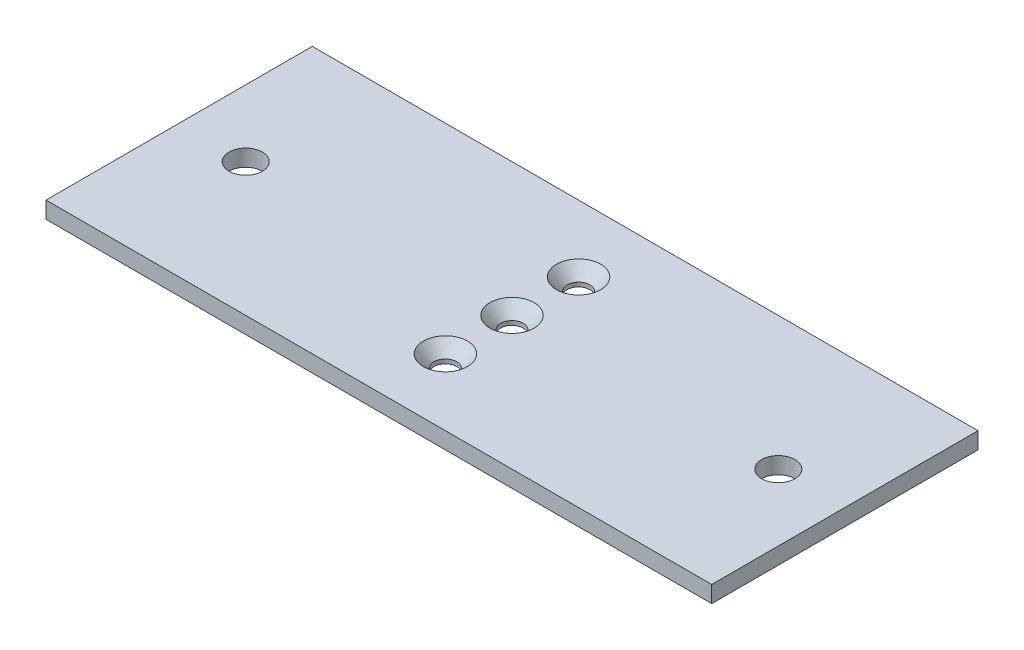
from build123d import *

# Parameters (mm, degrees)
SKETCH1_W                                     = 127
SKETCH1_H                                     = 50.8
BOSS_EXTRUDE1_DEPTH                           = 3.175
SKETCH2_R                                     = 3.175
CUT_EXTRUDE1_DEPTH                            = 6.35
CSK_FOR_8_FLAT_HEAD_MACHINE_SCREW1_AT_2_COUNT = 2
CSK_FOR_8_FLAT_HEAD_MACHINE_SCREW1_AT_2_PITCH = 12.7
CSK_FOR_8_FLAT_HEAD_MACHINE_SCREW1_AT_3_COUNT = 2
CSK_FOR_8_FLAT_HEAD_MACHINE_SCREW1_AT_3_PITCH = 25.4


with BuildPart() as part:
    # Sketch1 → Boss-Extrude1 (new body)
    with BuildSketch(Plane(origin=(0, 0, 0), x_dir=(1, 0, 0), z_dir=(0, 1, 0))):
        with Locations((63.5, 25.4)):
            Rectangle(SKETCH1_W, SKETCH1_H)
    extrude(amount=BOSS_EXTRUDE1_DEPTH)

    # Sketch2 → Cut-Extrude1 (cut)
    with BuildSketch(Plane(origin=(0, 3.175, 0), x_dir=(1, 0, 0), z_dir=(0, 1, 0))):
        with Locations(Location((12.7, 25.4, 0), (0, 0, 270))):
            Circle(SKETCH2_R)
        with Locations(Location((114.3, 25.4, 0), (0, 0, 270))):
            Circle(SKETCH2_R)
    extrude(amount=-CUT_EXTRUDE1_DEPTH, mode=Mode.SUBTRACT)

    # Sketch4 → CSK for #8 Flat Head Machine Screw1 (revolve, cut)
    with BuildSketch(Plane(origin=(63.5, 3.175, -12.7), x_dir=(0, 0, 1), z_dir=(1, 0, 0))):
        Polygon((0, 0), (0, 3.175), (2.15265, 3.175), (2.15265, 2.3740728), (4.2164, 0), align=None)
    csk_for_8_flat_head_machine_screw1 = revolve(axis=Axis((63.5, 9.525, -12.7), (0, -1, 0)), mode=Mode.SUBTRACT)

    # CSK for #8 Flat Head Machine Screw1 at 2: CSK for #8 Flat Head Machine Screw1 ×2
    with Locations(*[(0, 0, -i * CSK_FOR_8_FLAT_HEAD_MACHINE_SCREW1_AT_2_PITCH) for i in range(1, CSK_FOR_8_FLAT_HEAD_MACHINE_SCREW1_AT_2_COUNT)]):
        add(csk_for_8_flat_head_machine_screw1, mode=Mode.SUBTRACT)

    # CSK for #8 Flat Head Machine Screw1 at 3: CSK for #8 Flat Head Machine Screw1 ×2
    with Locations(*[(0, 0, -i * CSK_FOR_8_FLAT_HEAD_MACHINE_SCREW1_AT_3_PITCH) for i in range(1, CSK_FOR_8_FLAT_HEAD_MACHINE_SCREW1_AT_3_COUNT)]):
        add(csk_for_8_flat_head_machine_screw1, mode=Mode.SUBTRACT)


solid = part.part
